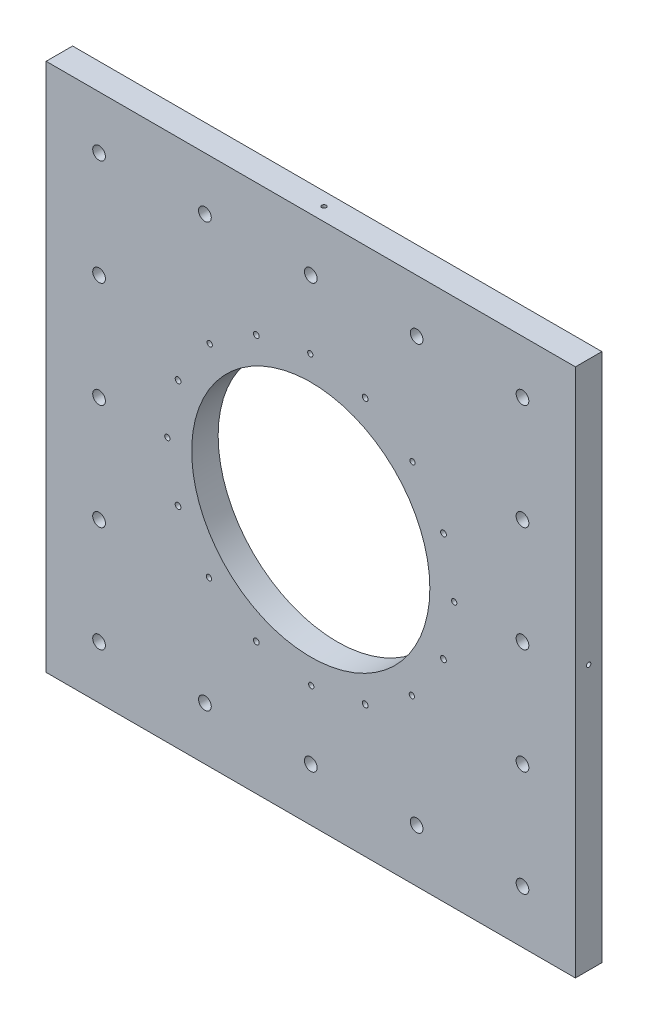
from build123d import *

# Parameters (mm, degrees)
SKETCH_4_W                  = 500
SKETCH_4_H                  = 500
EXTRUDE_2_DEPTH             = 25
SKETCH_9_R                  = 112.5
CUT_EXTRUDE_2_DEPTH         = 100
HOLE_WIZARD_1_4_28_2_D      = 5.4102
PATTERN_CIRCULAR_3_COUNT    = 4
M6X1_0_2_D                  = 5
PATTERN_CIRCULAR_4_COUNT    = 4
HOLE_WIZARD_M10_3_D         = 12
PATTERN_LINEAR_1_COUNT      = 5
PATTERN_LINEAR_1_PITCH      = 100
PATTERN_LINEAR_1_COUNT_DIR2 = 5
PATTERN_LINEAR_1_PITCH_DIR2 = 100
PATTERN_CIRCULAR_5_COUNT    = 4


with BuildPart() as part:
    # ｽｹｯﾁ4 → ﾎﾞｽ - 押し出し2 (new body)
    with BuildSketch(Plane.XY):
        Rectangle(SKETCH_4_W, SKETCH_4_H)
    extrude(amount=EXTRUDE_2_DEPTH)

    # ｽｹｯﾁ9 → ｶｯﾄ - 押し出し2 (cut)
    with BuildSketch(Plane.XY.offset(25)):
        Circle(SKETCH_9_R)
    extrude(amount=-CUT_EXTRUDE_2_DEPTH, mode=Mode.SUBTRACT)

    # 1/4-28 ねじ穴2 (through all)
    with Locations(Plane(origin=(125.365916841, 51.416309616, 25), x_dir=(1, 0, 0), z_dir=(0, 0, 1))):
        with Locations((0, 0), (0, -102.832619232)):
            hole_wizard_1_4_28_2 = Hole(HOLE_WIZARD_1_4_28_2_D / 2)

    # 円形ﾊﾟﾀｰﾝ3: 1/4-28 ねじ穴2 ×4 about axis
    pattern_circular_3_axis = Axis((0, 0, 0), (0, 0, 1))
    for i in range(1, PATTERN_CIRCULAR_3_COUNT):
        add(hole_wizard_1_4_28_2.rotate(pattern_circular_3_axis, i * 360 / PATTERN_CIRCULAR_3_COUNT), mode=Mode.SUBTRACT)

    # M6x1.0 ねじ穴2 (through all)
    with Locations(Plane(origin=(96.146834801, 95.47793545, 25), x_dir=(1, 0, 0), z_dir=(0, 0, 1))):
        with Locations((0, 0), (39.352339687, -95.004952183)):
            m6x1_0_2 = Hole(M6X1_0_2_D / 2)

    # 円形ﾊﾟﾀｰﾝ4: M6x1.0 ねじ穴2 ×4 about axis
    pattern_circular_4_axis = Axis((0, 0, 0), (0, 0, 1))
    for i in range(1, PATTERN_CIRCULAR_4_COUNT):
        add(m6x1_0_2.rotate(pattern_circular_4_axis, i * 360 / PATTERN_CIRCULAR_4_COUNT), mode=Mode.SUBTRACT)

    # M10 すきま穴3 (through all)
    with Locations(Plane(origin=(200, 200, 0), x_dir=(-1, 0, 0), z_dir=(0, 0, -1))):
        with Locations((0, 0)):
            hole_wizard_m10_3 = Hole(HOLE_WIZARD_M10_3_D / 2)

    # 直線ﾊﾟﾀｰﾝ1: Hole Wizard M10 _3 5 × 5, 9 skipped
    with Locations(*[(-i * PATTERN_LINEAR_1_PITCH, -j * PATTERN_LINEAR_1_PITCH_DIR2, 0) for i in range(PATTERN_LINEAR_1_COUNT) for j in range(PATTERN_LINEAR_1_COUNT_DIR2) if (i, j) not in ((0, 0), (1, 1), (1, 2), (1, 3), (2, 1), (2, 2), (2, 3), (3, 1), (3, 2), (3, 3))]):
        add(hole_wizard_m10_3, mode=Mode.SUBTRACT)

    # ｽｹｯﾁ27 → M5x0.8 ねじ穴2 (revolve, cut)
    with BuildSketch(Plane(origin=(-250, 0, 12.5), x_dir=(0, 0, 1), z_dir=(0, 1, 0))):
        Polygon((0, 0), (0, 9.2618073), (2.1, 8), (2.1, 0), align=None)
    m5x0_8_2 = revolve(axis=Axis((-256.35, 0, 12.5), (1, 0, 0)), mode=Mode.SUBTRACT)

    # 円形ﾊﾟﾀｰﾝ5: M5x0.8 ねじ穴2 ×4 about axis
    pattern_circular_5_axis = Axis((0, 0, -171.019585974), (0, 0, 1))
    for i in range(1, PATTERN_CIRCULAR_5_COUNT):
        add(m5x0_8_2.rotate(pattern_circular_5_axis, i * 360 / PATTERN_CIRCULAR_5_COUNT), mode=Mode.SUBTRACT)


solid = part.part
